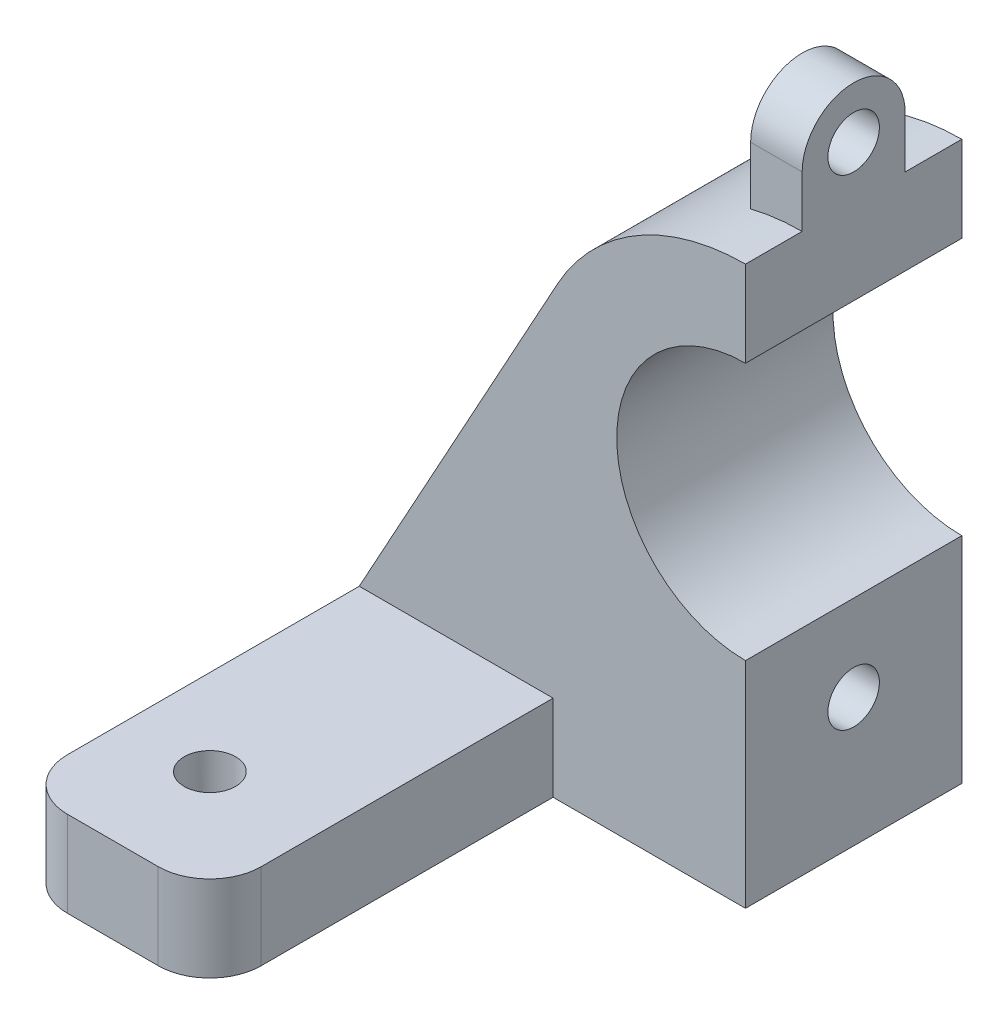
from build123d import *

# Parameters (mm, degrees)
SKETCH_1_R          = 7.5
EXTRUDE_1_DEPTH     = 12.6
SKETCH_2_W          = 11.291748881
SKETCH_2_H          = 5
EXTRUDE_2_DEPTH     = 32.6
SKETCH_3_R          = 1.5
CUT_EXTRUDE_1_DEPTH = 45.373528145
FILLET_1_R          = 3
SKETCH_4_W          = 3
SKETCH_4_H          = 15
EXTRUDE_3_DEPTH     = 20
SKETCH_5_R          = 1.3
CUT_EXTRUDE_2_DEPTH = 46.967488511
SKETCH_6_W          = 36.00279958
SKETCH_6_H          = 34.73430716
CUT_EXTRUDE_3_DEPTH = 46.967488511
SKETCH_7_R          = 1.5
EXTRUDE_4_DEPTH     = 3
SKETCH_8_R          = 1.5
CUT_EXTRUDE_4_DEPTH = 45.373528145
SKETCH_9_R          = 3
CUT_EXTRUDE_5_DEPTH = 4


with BuildPart() as part:
    # 草图1 → 凸台-拉伸1 (new body)
    with BuildSketch(Plane.XY):
        with BuildLine():
            Line((-10.956194261, 6.017624724), (-22.5, -15))
            Line((-22.5, -15), (-22.5, -20))
            Line((-22.5, -20), (22.5, -20))
            Line((22.5, -20), (22.5, -15))
            Line((22.5, -15), (10.956194261, 6.017624724))
            ThreePointArc((10.956194261, 6.017624724), (0, 12.5), (-10.956194261, 6.017624724))
        make_face()
        Circle(SKETCH_1_R, mode=Mode.SUBTRACT)
    extrude(amount=EXTRUDE_1_DEPTH)

    # 草图2 → 凸台-拉伸2 (add)
    with BuildSketch(Plane.XY):
        with Locations((-16.854125559, -17.5)):
            Rectangle(SKETCH_2_W, SKETCH_2_H)
        with Locations((16.854125559, -17.5)):
            Rectangle(SKETCH_2_W, SKETCH_2_H)
    extrude(amount=EXTRUDE_2_DEPTH)

    # 草图3 → 切除-拉伸1 (cut, through all)
    with BuildSketch(Plane(origin=(0, 0, 0), x_dir=(1, 0, 0), z_dir=(0, 1, 0))):
        with Locations(Location((-17.5, -26.3, 0), (0, 0, 270))):
            Circle(SKETCH_3_R)
        with Locations((17.5, -26.3)):
            Circle(SKETCH_3_R)
    extrude(amount=-CUT_EXTRUDE_1_DEPTH, mode=Mode.SUBTRACT)

    # 圆角1
    fillet_1_edges = [part.edges().sort_by_distance(p)[0] for p in [
        (-22.5, -17.5, 32.6),
        (-11.208251119, -17.5, 32.6),
        (11.208251119, -17.5, 32.6),
    ]]
    fillet(fillet_1_edges, radius=FILLET_1_R)

    # 草图4 → 凸台-拉伸3 (add, through all)
    with BuildSketch(Plane(origin=(0, 0, 0), x_dir=(1, 0, 0), z_dir=(0, 1, 0))):
        with Locations((24, -25.1)):
            Rectangle(SKETCH_4_W, SKETCH_4_H)
    extrude(amount=-EXTRUDE_3_DEPTH)

    # 草图5 → 切除-拉伸2 (cut, through all)
    with BuildSketch(Plane(origin=(0, 0, 0), x_dir=(0, 0, -1), z_dir=(1, 0, 0))):
        with Locations(Location((-25.1, -3, 0), (0, 0, 180))):
            Circle(SKETCH_5_R)
        with Locations(Location((-25.1, -12.5, 0), (0, 0, 180))):
            Circle(SKETCH_5_R)
    extrude(amount=CUT_EXTRUDE_2_DEPTH, mode=Mode.SUBTRACT)

    # 草图6 → 切除-拉伸3 (cut, through all)
    with BuildSketch(Plane(origin=(0, 0, 0), x_dir=(0, 0, -1), z_dir=(1, 0, 0))):
        with Locations((-15.759025291, -4.011160204)):
            Rectangle(SKETCH_6_W, SKETCH_6_H)
    extrude(amount=CUT_EXTRUDE_3_DEPTH, mode=Mode.SUBTRACT)

    # 草图7 → 凸台-拉伸4 (add)
    with BuildSketch(Plane(origin=(0, 0, 0), x_dir=(0, 0, -1), z_dir=(1, 0, 0))):
        with BuildLine():
            Line((-9.3, 7.5), (-9.3, 12.5))
            Line((-9.3, 12.5), (-9.3, 15.5))
            ThreePointArc((-9.3, 15.5), (-6.3, 18.5), (-3.3, 15.5))
            Line((-3.3, 15.5), (-3.3, 7.5))
            Line((-3.3, 7.5), (-9.3, 7.5))
        make_face()
        with Locations((-6.3, 15.5)):
            Circle(SKETCH_7_R, mode=Mode.SUBTRACT)
    extrude(amount=-EXTRUDE_4_DEPTH)

    # 草图8 → 切除-拉伸4 (cut, through all)
    with BuildSketch(Plane(origin=(0, 0, 0), x_dir=(0, 0, -1), z_dir=(1, 0, 0))):
        with Locations((-6.3, -12.5)):
            Circle(SKETCH_8_R)
    extrude(amount=-CUT_EXTRUDE_4_DEPTH, mode=Mode.SUBTRACT)

    # 草图9 → 切除-拉伸5 (cut)
    with BuildSketch(Plane(origin=(-22.5, 0, 0), x_dir=(0, 0, -1), z_dir=(1, 0, 0))):
        with Locations(Location((-6.3, -12.5, 0), (0, 0, 236.442690238))):
            Circle(SKETCH_9_R)
    extrude(amount=CUT_EXTRUDE_5_DEPTH, mode=Mode.SUBTRACT)


solid = part.part
